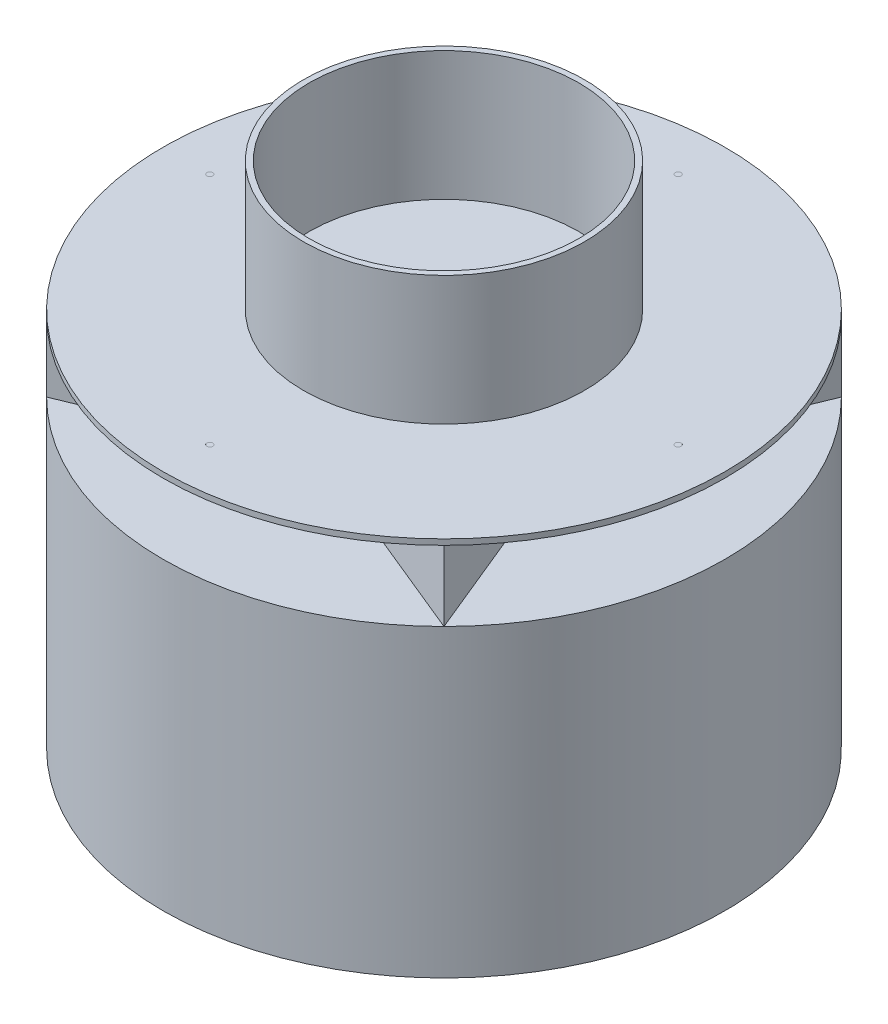
from build123d import *

# Parameters (mm, degrees)
SKETCH11_R          = 304.8
BOSS_EXTRUDE5_DEPTH = 330.2
BOSS_EXTRUDE6_DEPTH = 76.2
SKETCH13_R          = 304.8
BOSS_EXTRUDE7_DEPTH = 6.096
SKETCH14_R          = 152.4
SKETCH14_R_2        = 146.304
BOSS_EXTRUDE8_DEPTH = 139.7
SKETCH16_R          = 3.175
CUT_EXTRUDE2_DEPTH  = 0.0254


with BuildPart() as part:
    # Sketch11 → Boss-Extrude5 (new body)
    with BuildSketch(Plane(origin=(0, 0, 0), x_dir=(1, 0, 0), z_dir=(0, 1, 0))):
        with Locations(Location((0, 0, 0), (0, 0, 270))):
            Circle(SKETCH11_R)
    extrude(amount=BOSS_EXTRUDE5_DEPTH)

    # Sketch12 → Boss-Extrude6 (add)
    with BuildSketch(Plane(origin=(0, 330.2, 0), x_dir=(1, 0, 0), z_dir=(0, 1, 0))):
        Polygon((-127, 0), (-215.526146906, -215.526146906), (0, -127), (215.526146906, -215.526146906), (127, 0), (215.526146906, 215.526146906), (0, 127), (-215.526146906, 215.526146906), align=None)
    extrude(amount=BOSS_EXTRUDE6_DEPTH)

    # Sketch13 → Boss-Extrude7 (add)
    with BuildSketch(Plane(origin=(0, 406.4, 0), x_dir=(1, 0, 0), z_dir=(0, 1, 0))):
        with Locations(Location((0, 0, 0), (0, 0, 135))):
            Circle(SKETCH13_R)
    extrude(amount=BOSS_EXTRUDE7_DEPTH)

    # Sketch14 → Boss-Extrude8 (add)
    with BuildSketch(Plane(origin=(0, 412.496, 0), x_dir=(1, 0, 0), z_dir=(0, 1, 0))):
        with Locations(Location((0, 0, 0), (0, 0, 270))):
            Circle(SKETCH14_R)
        with Locations(Location((0, 0, 0), (0, 0, 270))):
            Circle(SKETCH14_R_2, mode=Mode.SUBTRACT)
    extrude(amount=BOSS_EXTRUDE8_DEPTH)

    # Sketch16 → Cut-Extrude2 (cut)
    with BuildSketch(Plane(origin=(0, 412.496, 0), x_dir=(1, 0, 0), z_dir=(0, 1, 0))):
        with Locations(Location((254, 0, 0), (0, 0, 270))):
            Circle(SKETCH16_R)
        with Locations(Location((0, 254, 0), (0, 0, 270))):
            Circle(SKETCH16_R)
        with Locations(Location((0, -254, 0), (0, 0, 270))):
            Circle(SKETCH16_R)
        with Locations(Location((-254, 0, 0), (0, 0, 270))):
            Circle(SKETCH16_R)
    extrude(amount=-CUT_EXTRUDE2_DEPTH, mode=Mode.SUBTRACT)


solid = part.part
